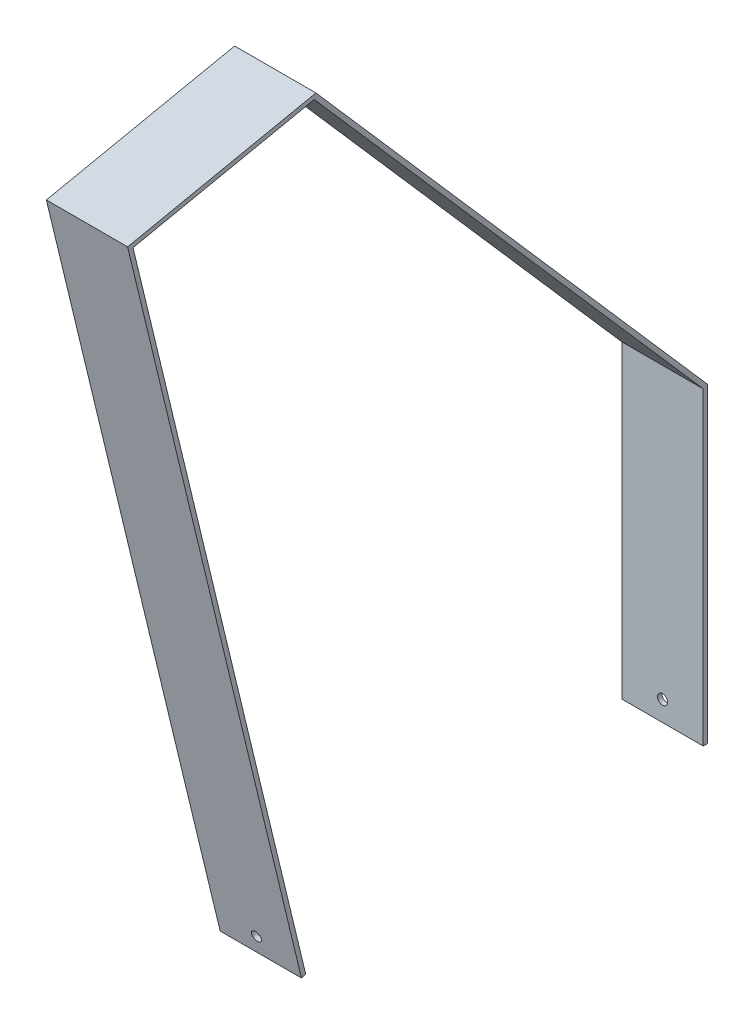
from build123d import *

# Parameters (mm, degrees)
BOSS_EXTRUDE2_DEPTH = 24.3
SKETCH5_R           = 3
CUT_EXTRUDE1_DEPTH  = 10
SKETCH10_R          = 3
CUT_EXTRUDE2_DEPTH  = 10


with BuildPart() as part:
    # Sketch4 → Boss-Extrude2 (new, symmetric)
    with BuildSketch(Plane.ZY.offset(-117.5682)):
        Polygon((-1089.668968128, 78.04), (-1089.668968128, 264.04), (-855.402894198, 532.098588009), (-742.813619106, 508.675199397), (-846.747853315, 78.04), (-849.333608688, 78.664074634), (-746.043555874, 506.630209448), (-854.422864001, 529.177744724), (-1087.008968128, 263.041459529), (-1087.008968128, 78.04), align=None)
    extrude(amount=BOSS_EXTRUDE2_DEPTH, both=True)

    # Sketch5 → Cut-Extrude1 (cut)
    with BuildSketch(Plane(origin=(0, 0, -1089.668968128), x_dir=(-1, 0, 0), z_dir=(0, 0, -1))):
        with Locations((-117.5682, 90.04090214)):
            Circle(SKETCH5_R)
    extrude(amount=-CUT_EXTRUDE1_DEPTH, mode=Mode.SUBTRACT)

    # Sketch10 → Cut-Extrude2 (cut)
    with BuildSketch(Plane(origin=(0, 198.034168105, -820.523517758), x_dir=(-1, 0, 0), z_dir=(0, 0.23461452417479184, -0.9720884862224406))):
        with Locations(Location((-117.5682, -111.819624777, 0), (0, 0, 90))):
            Circle(SKETCH10_R)
    extrude(amount=-CUT_EXTRUDE2_DEPTH, mode=Mode.SUBTRACT)


solid = part.part
